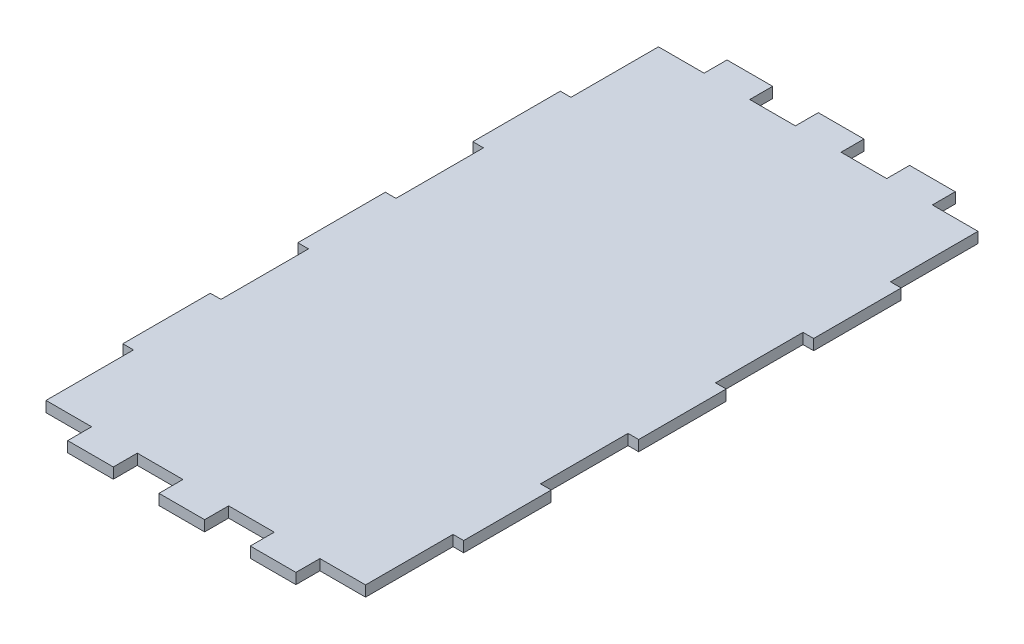
from build123d import *

# Parameters (mm, degrees)
SKETCH_4_W      = 60
SKETCH_4_H      = 115
EXTRUDE_1_DEPTH = 2
SKETCH_5_W      = 8.571428572
SKETCH_5_H      = 2
EXTRUDE_2_DEPTH = 4.5
EXTRUDE_START   = -115
SKETCH_5_3_W    = 8.571428572
SKETCH_5_3_H    = 2
EXTRUDE_3_DEPTH = 4.3
SKETCH_6_W      = 16.428571428
SKETCH_6_H      = 2
EXTRUDE_4_DEPTH = 2
EXTRUDE_START_2 = -60
SKETCH_6_2_W    = 16.428571428
SKETCH_6_2_H    = 2
EXTRUDE_5_DEPTH = 2


with BuildPart() as part:
    # 草图4 → 凸台-拉伸1 (new body)
    with BuildSketch(Plane(origin=(0, 0, 0), x_dir=(1, 0, 0), z_dir=(0, 1, 0))):
        Rectangle(SKETCH_4_W, SKETCH_4_H)
    extrude(amount=EXTRUDE_1_DEPTH)

    # 草图5 → 凸台-拉伸2 (add)
    with BuildSketch(Plane.XY.offset(57.5)):
        with Locations((17.142857143, 1)):
            Rectangle(SKETCH_5_W, SKETCH_5_H)
        with Locations((0, 1)):
            Rectangle(SKETCH_5_W, SKETCH_5_H)
        with Locations((-17.142857143, 1)):
            Rectangle(SKETCH_5_W, SKETCH_5_H)
    extrude(amount=EXTRUDE_2_DEPTH)

    # 草图5<3> → 凸台-拉伸3 (add)
    with BuildSketch(Plane.XY.offset(57.5).offset(EXTRUDE_START)):
        with Locations((17.142857143, 1)):
            Rectangle(SKETCH_5_3_W, SKETCH_5_3_H)
        with Locations((0, 1)):
            Rectangle(SKETCH_5_3_W, SKETCH_5_3_H)
        with Locations((-17.142857143, 1)):
            Rectangle(SKETCH_5_3_W, SKETCH_5_3_H)
    extrude(amount=-EXTRUDE_3_DEPTH)

    # 草图6 → 凸台-拉伸4 (add)
    with BuildSketch(Plane(origin=(30, 0, 0), x_dir=(0, 0, -1), z_dir=(1, 0, 0))):
        with Locations((-32.857142857, 1)):
            Rectangle(SKETCH_6_W, SKETCH_6_H)
        with Locations((0, 1)):
            Rectangle(SKETCH_6_W, SKETCH_6_H)
        with Locations((32.857142857, 1)):
            Rectangle(SKETCH_6_W, SKETCH_6_H)
    extrude(amount=EXTRUDE_4_DEPTH)

    # 草图6<2> → 凸台-拉伸5 (add)
    with BuildSketch(Plane(origin=(30, 0, 0), x_dir=(0, 0, -1), z_dir=(1, 0, 0)).offset(EXTRUDE_START_2)):
        with Locations((-32.857142857, 1)):
            Rectangle(SKETCH_6_2_W, SKETCH_6_2_H)
        with Locations((0, 1)):
            Rectangle(SKETCH_6_2_W, SKETCH_6_2_H)
        with Locations((32.857142857, 1)):
            Rectangle(SKETCH_6_2_W, SKETCH_6_2_H)
    extrude(amount=-EXTRUDE_5_DEPTH)


solid = part.part
